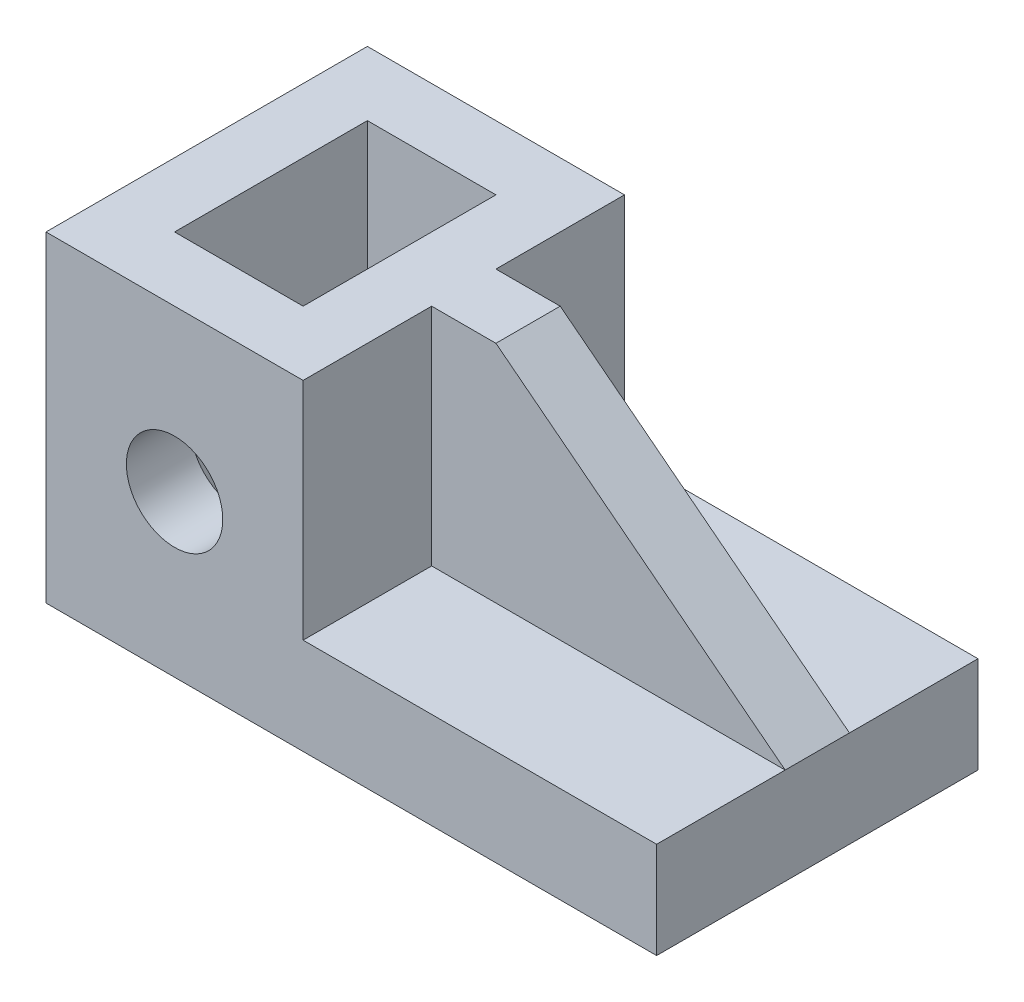
from build123d import *

# Parameters (mm, degrees)
BOSS_EXTRUDE1_DEPTH = 50
SKETCH2_W           = 20
SKETCH2_H           = 30
CUT_EXTRUDE1_DEPTH  = 50
SKETCH3_R           = 7.5
CUT_EXTRUDE2_DEPTH  = 50
SKETCH4_W           = 10
SKETCH4_H           = 10
BOSS_EXTRUDE2_DEPTH = 40
EXTRUDE_THIN1_DEPTH = 10
BOSS_EXTRUDE3_DEPTH = 10


with BuildPart() as part:
    # Sketch1 → Boss-Extrude1 (new body)
    with BuildSketch(Plane.XY):
        Polygon((-7.5, 25), (-7.5, -10), (47.5, -10), (47.5, -25), (-47.5, -25), (-47.5, 25), align=None)
    extrude(amount=-BOSS_EXTRUDE1_DEPTH)

    # Sketch2 → Cut-Extrude1 (cut)
    with BuildSketch(Plane(origin=(0, 25, 0), x_dir=(1, 0, 0), z_dir=(0, 1, 0))):
        with Locations((-27.5, 25)):
            Rectangle(SKETCH2_W, SKETCH2_H)
    extrude(amount=-CUT_EXTRUDE1_DEPTH, mode=Mode.SUBTRACT)

    # Sketch3 → Cut-Extrude2 (cut)
    with BuildSketch(Plane.XY):
        with Locations((-27.5, 0)):
            Circle(SKETCH3_R)
    extrude(amount=-CUT_EXTRUDE2_DEPTH, mode=Mode.SUBTRACT)

    # Sketch4 → Boss-Extrude2 (add)
    with BuildSketch(Plane(origin=(0, 25, 0), x_dir=(1, 0, 0), z_dir=(0, 1, 0))):
        with Locations((-2.5, 25)):
            Rectangle(SKETCH4_W, SKETCH4_H)
    extrude(amount=-BOSS_EXTRUDE2_DEPTH)

    # Sketch7 → Extrude-Thin1 (add)
    with BuildSketch(Plane.XY.offset(-20)):
        Polygon((2.5, 25), (47.5, -10), (41.360593865, -17.893522174), (-3.639406135, 17.106477826), align=None)
    extrude(amount=-EXTRUDE_THIN1_DEPTH)

    # Sketch8 → Boss-Extrude3 (add)
    with BuildSketch(Plane.XY.offset(-20)):
        Polygon((2.5, -10), (2.5, 12.331384166), (31.211779641, -10), align=None)
    extrude(amount=-BOSS_EXTRUDE3_DEPTH)


solid = part.part
